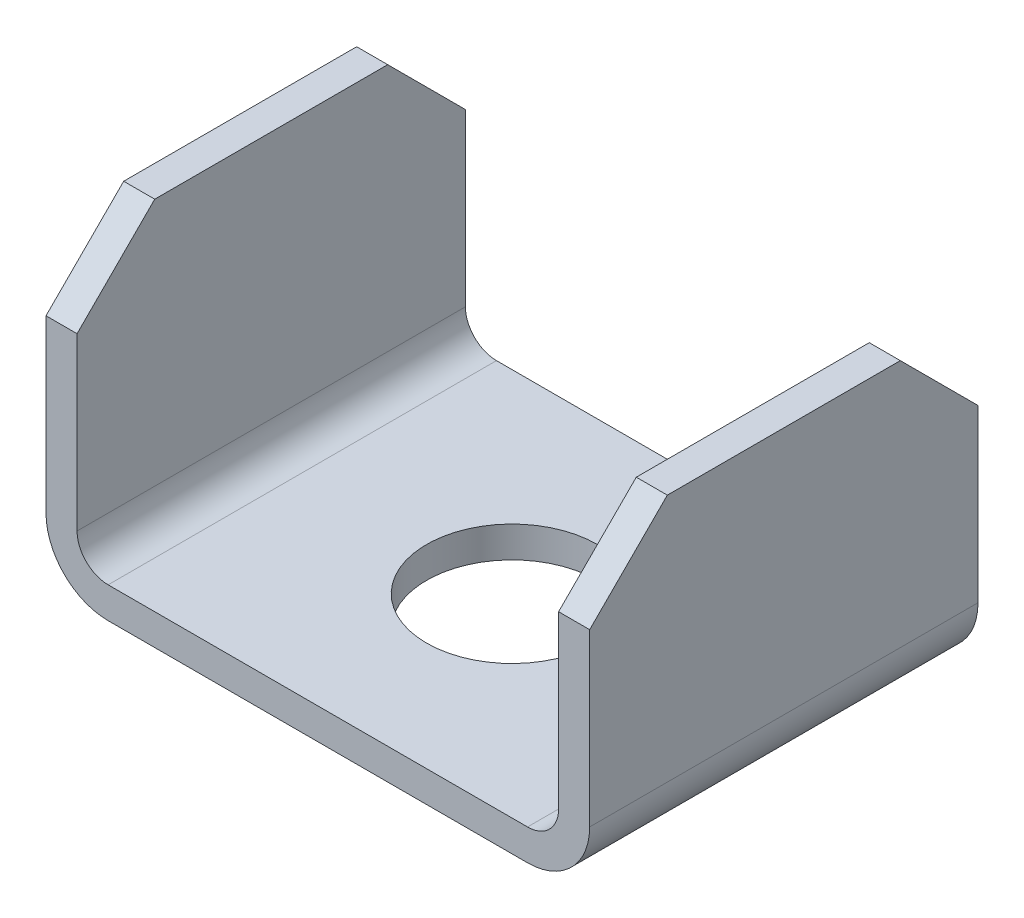
from build123d import *

# Parameters (mm, degrees)
SKETCH1_W           = 70
SKETCH1_H           = 40
BOSS_EXTRUDE1_DEPTH = 25
FILLET1_R           = 8
SHELL1_T            = -4
CHAMFER1_SIZE       = 10
CUT_EXTRUDE1_REACH  = 58.089
SKETCH2_R           = 11


with BuildPart() as part:
    # Sketch1 → Boss-Extrude1 (new, symmetric)
    with BuildSketch(Plane.XY):
        Rectangle(SKETCH1_W, SKETCH1_H)
    extrude(amount=BOSS_EXTRUDE1_DEPTH, both=True)

    # Fillet1
    fillet1_edges = [part.edges().sort_by_distance(p)[0] for p in [
        (35, -20, 0),
        (-35, -20, 0),
    ]]
    fillet(fillet1_edges, radius=FILLET1_R)

    # Shell1
    shell1_openings = [part.faces().sort_by_distance(p)[0] for p in [
        (0, 0.180447069, 25),
        (0, 0.180447069, -25),
        (0, 20, 0),
    ]]
    offset(amount=SHELL1_T, openings=shell1_openings, kind=Kind.INTERSECTION)

    # Chamfer1
    chamfer1_edges = [part.edges().sort_by_distance(p)[0] for p in [
        (-33, 20, -25),
        (-33, 20, 25),
        (33, 20, -25),
        (33, 20, 25),
    ]]
    chamfer(chamfer1_edges, length=CHAMFER1_SIZE)

    # Sketch2 → Cut-Extrude1 (cut, up to next)
    with BuildSketch(Plane(origin=(0, -16, 0), x_dir=(1, 0, 0), z_dir=(0, 1, 0)), mode=Mode.PRIVATE) as cut_extrude1_sk1:
        with Locations(Location((0, 0, 0), (0, 0, 270))):
            Circle(SKETCH2_R)
    cut_extrude1_tool1 = extrude(cut_extrude1_sk1.sketch, amount=-CUT_EXTRUDE1_REACH, mode=Mode.PRIVATE) & part.part
    add(cut_extrude1_tool1.solids().sort_by_distance((0, -16, 0))[0], mode=Mode.SUBTRACT)


solid = part.part
